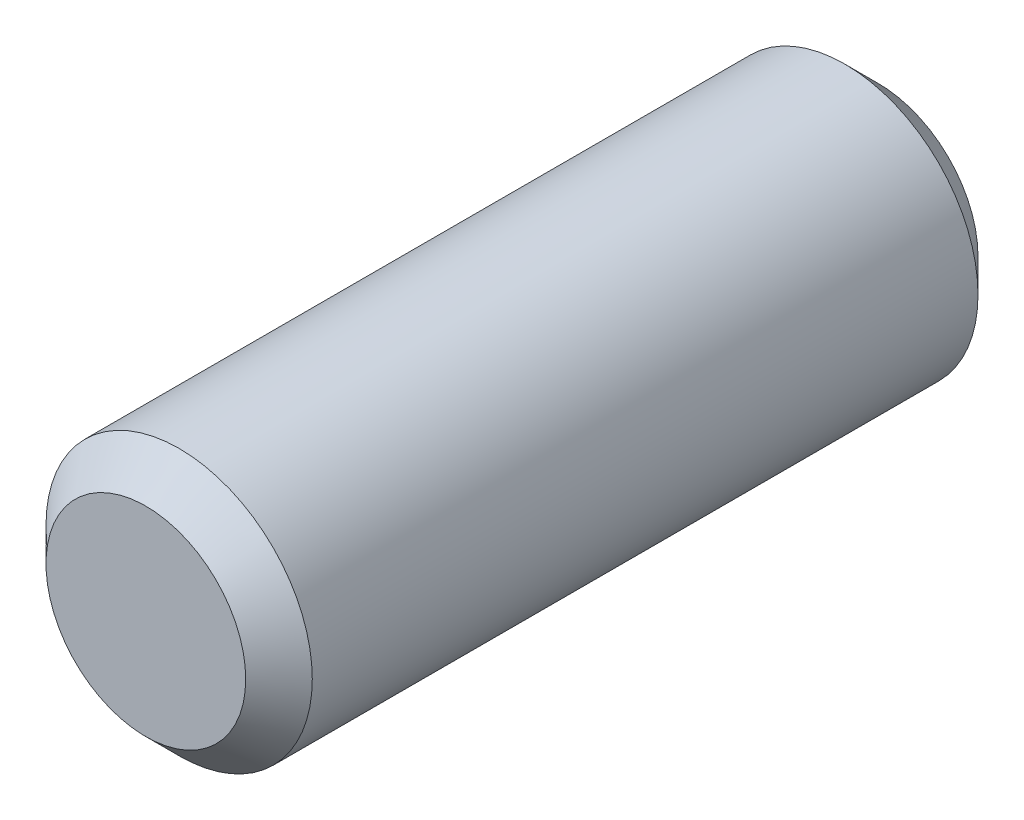
from build123d import *

# Parameters (mm, degrees)
ESQUISSE1_R        = 2
BOSS_EXTRU_1_DEPTH = 5.5
CHANFREIN1_SIZE    = 0.5


with BuildPart() as part:
    # Esquisse1 → Boss.-Extru.1 (new, symmetric)
    with BuildSketch(Plane.XY):
        Circle(ESQUISSE1_R)
    extrude(amount=BOSS_EXTRU_1_DEPTH, both=True)

    # Chanfrein1
    chanfrein1_edges = [part.edges().sort_by_distance(p)[0] for p in [
        (-2, 0, -5.5),
        (-2, 0, 5.5),
    ]]
    chamfer(chanfrein1_edges, length=CHANFREIN1_SIZE)


solid = part.part
